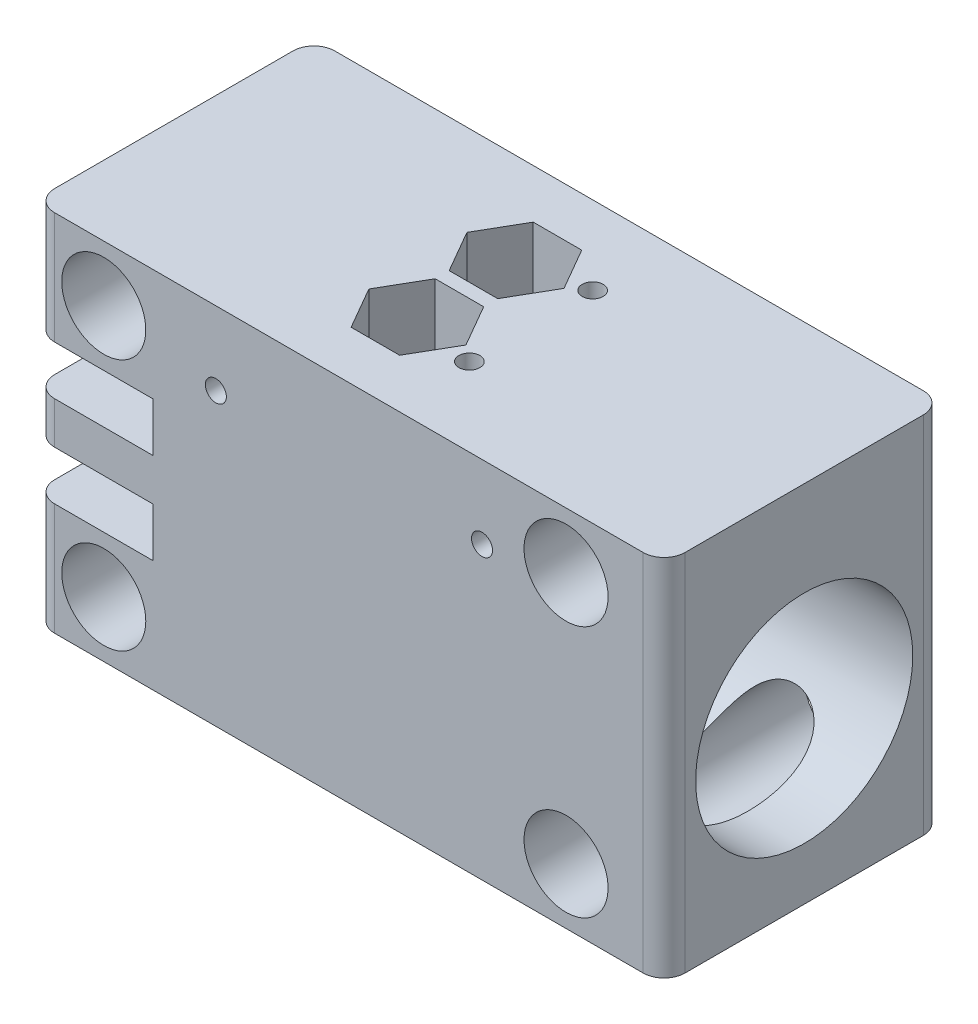
from build123d import *

# Parameters (mm, degrees)
SKETCH_1_W           = 90
SKETCH_1_H           = 52
EXTRUDE_1_DEPTH      = 40
SKETCH_2_R           = 6
CUT_EXTRUDE_1_DEPTH  = 66.582009728
SKETCH_3_R           = 1.5
CUT_EXTRUDE_2_DEPTH  = 80.555012413
SKETCH_6_R           = 1.5
CUT_EXTRUDE_4_DEPTH  = 8
SKETCH_8_W           = 17
SKETCH_8_H           = 20
CUT_EXTRUDE_5_DEPTH  = 66.582009728
SKETCH_17_W          = 30
SKETCH_17_H          = 30
CUT_EXTRUDE_18_DEPTH = 38
SKETCH_9_R           = 15.5
CUT_EXTRUDE_17_DEPTH = 30
SKETCH_21_W          = 17
SKETCH_21_H          = 6
EXTRUDE_7_DEPTH      = 40
FILLET_3_R           = 3
CUT_EXTRUDE_START    = -8
SKETCH_24_R          = 1.5
CUT_EXTRUDE_16_DEPTH = 8


with BuildPart() as part:
    # 草圖1 → 填料-伸長1 (new body)
    with BuildSketch(Plane.XY):
        Rectangle(SKETCH_1_W, SKETCH_1_H)
    extrude(amount=EXTRUDE_1_DEPTH)

    # 草圖2 → 除料-伸長1 (cut, through all)
    with BuildSketch(Plane(origin=(0, 0, 0), x_dir=(-1, 0, 0), z_dir=(0, 0, -1))):
        with Locations((-31, -18)):
            Circle(SKETCH_2_R)
        with Locations(Location((35, -18, 0), (0, 0, 180))):
            Circle(SKETCH_2_R)
        with Locations((35, 18)):
            Circle(SKETCH_2_R)
        with Locations(Location((-31, 18, 0), (0, 0, 180))):
            Circle(SKETCH_2_R)
    extrude(amount=-CUT_EXTRUDE_1_DEPTH, mode=Mode.SUBTRACT)

    # 草圖3 → 除料-伸長2 (cut, through all)
    with BuildSketch(Plane(origin=(0, 26, 0), x_dir=(1, 0, 0), z_dir=(0, 1, 0))):
        with Locations(Location((6, -28.8, 0), (0, 0, 270))):
            Circle(SKETCH_3_R)
        with Locations(Location((6, -11.2, 0), (0, 0, 270))):
            Circle(SKETCH_3_R)
        Polygon((3.706406461, -27), (0.242304845, -21), (-6.685898385, -21), (-10.15, -27), (-6.685898385, -33), (0.242304845, -33), align=None)
        Polygon((0.242304845, -7), (3.706406461, -13), (0.242304845, -19), (-6.685898385, -19), (-10.15, -13), (-6.685898385, -7), align=None)
    extrude(amount=-CUT_EXTRUDE_2_DEPTH, mode=Mode.SUBTRACT)

    # 草圖6 → 除料-伸長4 (cut)
    with BuildSketch(Plane(origin=(0, 0, 0), x_dir=(-1, 0, 0), z_dir=(0, 0, -1))):
        with Locations((-19, 15.5)):
            Circle(SKETCH_6_R)
        with Locations((19, 15.5)):
            Circle(SKETCH_6_R)
    extrude(amount=-CUT_EXTRUDE_4_DEPTH, mode=Mode.SUBTRACT)

    # 草圖8 → 除料-伸長5 (cut, through all)
    with BuildSketch(Plane(origin=(0, 0, 0), x_dir=(-1, 0, 0), z_dir=(0, 0, -1))):
        with Locations((36.5, 0)):
            Rectangle(SKETCH_8_W, SKETCH_8_H)
    extrude(amount=-CUT_EXTRUDE_5_DEPTH, mode=Mode.SUBTRACT)

    # 草圖17 → 除料-伸長18 (cut)
    with BuildSketch(Plane.XZ.offset(26)):
        with Locations((0, 20)):
            Rectangle(SKETCH_17_W, SKETCH_17_H)
    extrude(amount=-CUT_EXTRUDE_18_DEPTH, mode=Mode.SUBTRACT)

    # 草圖9 → 除料-伸長17 (cut)
    with BuildSketch(Plane(origin=(45, 0, 0), x_dir=(0, 0, -1), z_dir=(1, 0, 0))):
        with Locations((-20, -3)):
            Circle(SKETCH_9_R)
    extrude(amount=-CUT_EXTRUDE_17_DEPTH, mode=Mode.SUBTRACT)

    # 草圖21 → 填料-伸長7 (add)
    with BuildSketch(Plane.XY.offset(40)):
        with Locations((-36.5, 0)):
            Rectangle(SKETCH_21_W, SKETCH_21_H)
    extrude(amount=-EXTRUDE_7_DEPTH)

    # 圓角3
    fillet_3_edges = [part.edges().sort_by_distance(p)[0] for p in [
        (45, 0, 40),
        (-45, 0, 40),
        (-45, 0, 0),
        (-45, 18, 40),
        (45, 0, 0),
        (-45, 18, 0),
        (-45, -18, 0),
        (-45, -18, 40),
    ]]
    fillet(fillet_3_edges, radius=FILLET_3_R)

    # 草圖24 → 除料-伸長16 (cut)
    with BuildSketch(Plane.XY.offset(40).offset(CUT_EXTRUDE_START)):
        with Locations(Location((-19, 15.5, 0), (0, 0, 180))):
            Circle(SKETCH_24_R)
        with Locations(Location((19, 15.5, 0), (0, 0, 180))):
            Circle(SKETCH_24_R)
    extrude(amount=CUT_EXTRUDE_16_DEPTH, mode=Mode.SUBTRACT)


solid = part.part
